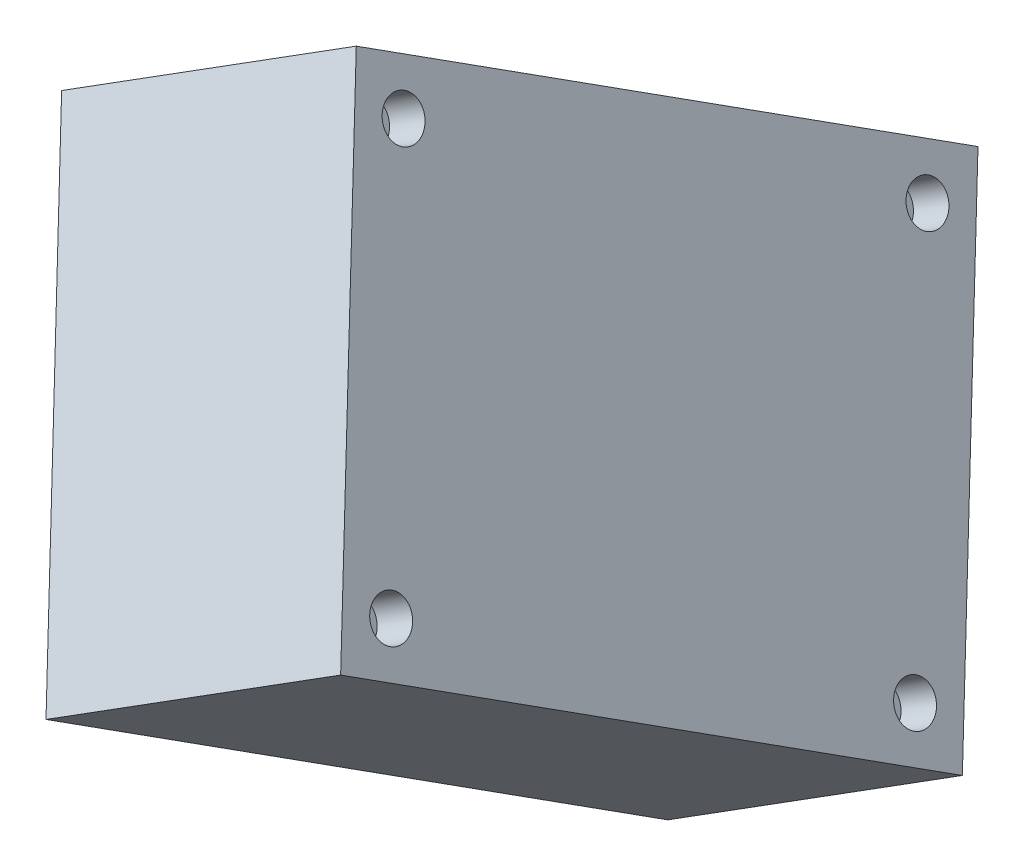
from build123d import *

# Parameters (mm, degrees)
SKETCH2_W           = 98.5
SKETCH2_H           = 75.5
BOSS_EXTRUDE1_DEPTH = 52.7
SKETCH3_R           = 3.4
CUT_EXTRUDE1_DEPTH  = 6.35


with BuildPart() as part:
    # Sketch2 → Boss-Extrude1 (new body)
    with BuildSketch(Plane(origin=(-280.607858618, -167.099490539, 26.56047255), x_dir=(0.20194112114307833, -0.4752369827921409, -0.8563700098544431), z_dir=(0.8563700098544432, 0.5099607440240832, -0.08105828629020287))):
        with Locations((-366.420746544, 1.273500466)):
            Rectangle(SKETCH2_W, SKETCH2_H)
    extrude(amount=BOSS_EXTRUDE1_DEPTH)

    # Sketch3 → Cut-Extrude1 (cut)
    with BuildSketch(Plane(origin=(-235.477159099, -140.224559329, 22.288700862), x_dir=(0.20194112114307847, -0.47523698279214077, -0.8563700098544431), z_dir=(0.8563700098544432, 0.5099607440240833, -0.0810582862902027))):
        with Locations(Location((-407.920746544, 31.273500466, 0), (0, 0, 120.773423267))):
            Circle(SKETCH3_R)
        with Locations(Location((-407.920746544, -28.726499534, 0), (0, 0, 120.773423267))):
            Circle(SKETCH3_R)
        with Locations(Location((-324.920746544, 31.273500466, 0), (0, 0, 120.773423267))):
            Circle(SKETCH3_R)
        with Locations(Location((-324.920746544, -28.726499534, 0), (0, 0, 120.773423267))):
            Circle(SKETCH3_R)
    extrude(amount=-CUT_EXTRUDE1_DEPTH, mode=Mode.SUBTRACT)


solid = part.part
